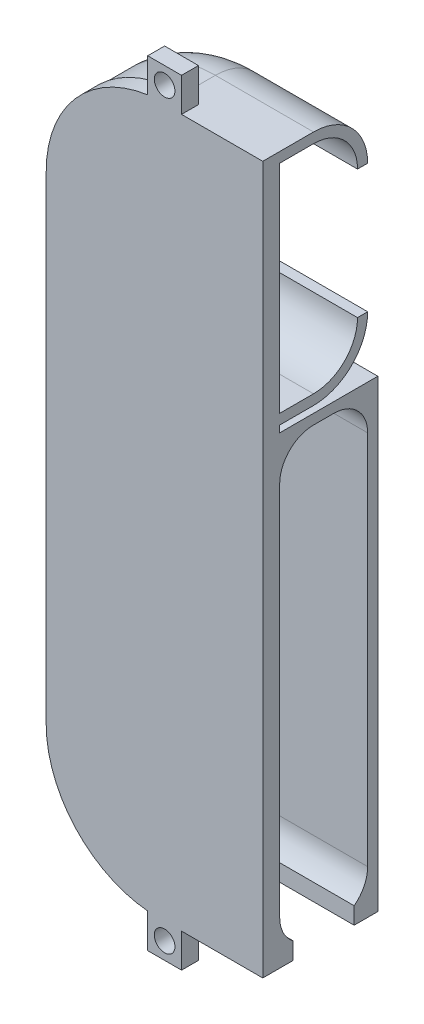
from build123d import *

# Parameters (mm, degrees)
FILLET1_R           = 10
SKETCH12_R          = 3.05
SKETCH12_W          = 10
SKETCH12_H          = 10
BOSS_EXTRUDE4_DEPTH = 5
FILLET2_R           = 10
CUT_EXTRUDE5_REACH  = 198.959
SKETCH13_W          = 18
SKETCH13_H          = 100
REVOLVE2_ANGLE      = 180
BOSS_EXTRUDE5_DEPTH = 29
FILLET3_R           = 9
SKETCH15_W          = 42.078105567
SKETCH15_H          = 93.156211134
SKETCH15_W_2        = 21.921894433
SKETCH15_H_2        = 51
BOSS_EXTRUDE6_DEPTH = 3


with BuildPart() as part:
    # Sweep1: sweep along a path in r
    with BuildLine(Plane.XY) as sweep1_path:
        Line((29, -171), (-2, -171))
        ThreePointArc((-2, -171), (-23.213203436, -162.213203436), (-32, -141))
        Line((-32, -141), (-32, -40))
        Line((-32, -40), (29, -40))
    # Sketch11 → Sweep1 (sweep)
    with BuildSketch(Plane(origin=(29, 0, 0), x_dir=(0, 0, -1), z_dir=(1, 0, 0))):
        Polygon((0, -171), (0, -174), (29, -174), (29, -152.078105567), (26, -152.078105567), (26, -171), align=None)
    sweep(path=sweep1_path.line, transition=Transition.RIGHT)

    # Fillet1
    fillet1_edges = [part.edges().sort_by_distance(p)[0] for p in [
        (-23.213203436, -162.213203436, -26),
        (-32, -90.5, -26),
        (-1.5, -40, -26),
        (13.5, -171, -26),
    ]]
    fillet(fillet1_edges, radius=FILLET1_R)

    # Sketch12 → Boss-Extrude4 (add)
    # profile 1 of 2: a face of its own
    with BuildSketch(Plane.XY):
        with BuildLine():
            Line((29, 35), (5, 35))
            Line((5, 35), (-5, 35))
            ThreePointArc((-5, 35), (-26.575819403, 23.136416631), (-35, 0))
            Line((-35, 0), (-35, -141))
            ThreePointArc((-35, -141), (-26.372115214, -163.248595461), (-5, -173.86335345))
            Line((-5, -173.86335345), (-5, -184))
            Line((-5, -184), (5, -184))
            Line((5, -184), (5, -174))
            Line((5, -174), (29, -174))
            Line((29, -174), (29, 35))
        make_face()
        with Locations((0, -179)):
            Circle(SKETCH12_R, mode=Mode.SUBTRACT)
    # profile 2 of 2: a face of its own
    with BuildSketch(Plane.XY):
        with Locations((0, 40)):
            Rectangle(SKETCH12_W, SKETCH12_H)
        with Locations((0, 40)):
            Circle(SKETCH12_R, mode=Mode.SUBTRACT)
    extrude(amount=BOSS_EXTRUDE4_DEPTH)

    # Fillet2
    fillet2_edges = [part.edges().sort_by_distance(p)[0] for p in [
        (-23.213203436, -162.213203436, 0),
        (-32, -90.5, 0),
        (-1.5, -40, 0),
        (13.5, -171, 0),
    ]]
    fillet(fillet2_edges, radius=FILLET2_R)

    # Sketch13 → Cut-Extrude5 (cut, up to next)
    with BuildSketch(Plane.ZY.offset(35), mode=Mode.PRIVATE) as cut_extrude5_sk1:
        with Locations((-13, -126.5)):
            Rectangle(SKETCH13_W, SKETCH13_H)
    cut_extrude5_tool1 = extrude(cut_extrude5_sk1.sketch, amount=-CUT_EXTRUDE5_REACH, mode=Mode.PRIVATE) & part.part
    add(cut_extrude5_tool1.solids().sort_by_distance((-35, -126.5, -13))[0], mode=Mode.SUBTRACT)

    # Sketch14 → Revolve2 (revolve)
    with BuildSketch(Plane(origin=(0, 0, 0), x_dir=(0, 0, -1), z_dir=(1, 0, 0))):
        with BuildLine():
            Line((0, -35), (10, -35))
            ThreePointArc((10, -35), (21.313708499, -30.313708499), (26, -19))
            Line((26, -19), (23, -19))
            ThreePointArc((23, -19), (19.192388155, -28.192388155), (10, -32))
            Line((10, -32), (0, -32))
            Line((0, -32), (0, -35))
        make_face()
    revolve(axis=Axis((0, 0, -23), (0, 0, -1)), revolution_arc=REVOLVE2_ANGLE)

    # Sketch14<4> → Boss-Extrude5 (add, through all)
    with BuildSketch(Plane(origin=(0, 0, 0), x_dir=(0, 0, -1), z_dir=(1, 0, 0))):
        with BuildLine():
            Line((0, -32), (0, -35))
            Line((0, -35), (10, -35))
            ThreePointArc((10, -35), (21.313708499, -30.313708499), (26, -19))
            Line((26, -19), (23, -19))
            ThreePointArc((23, -19), (19.192388155, -28.192388155), (10, -32))
            Line((10, -32), (0, -32))
        make_face()
    boss_extrude5 = extrude(amount=BOSS_EXTRUDE5_DEPTH)

    # Mirror1: Boss-Extrude5 across plane
    add(boss_extrude5.mirror(Plane.ZX))

    # Fillet3
    fillet3_edges = [part.edges().sort_by_distance(p)[0] for p in [
        (-35, -37, -14.5),
    ]]
    fillet(fillet3_edges, radius=FILLET3_R)

    # Sketch15 → Boss-Extrude6 (add)
    with BuildSketch(Plane(origin=(0, 0, -29), x_dir=(-1, 0, 0), z_dir=(0, 0, -1))):
        with Locations((-7.960947217, -105.5)):
            Rectangle(SKETCH15_W, SKETCH15_H)
        with Locations((24.039052784, -102)):
            Rectangle(SKETCH15_W_2, SKETCH15_H_2)
    extrude(amount=-BOSS_EXTRUDE6_DEPTH)


solid = part.part
